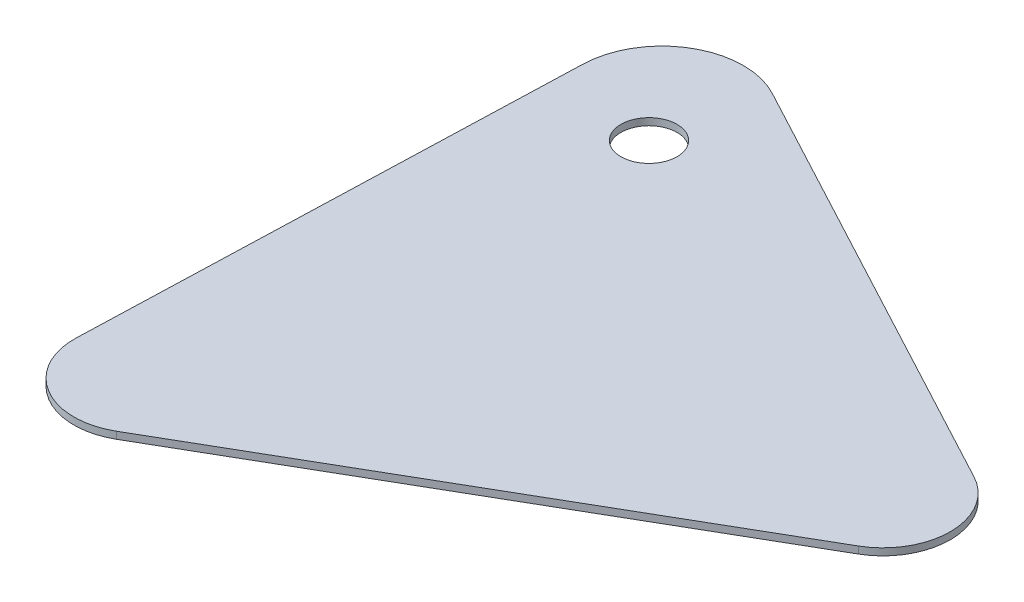
from build123d import *

# Parameters (mm, degrees)
BOSS_EXTRUDE1_DEPTH = 3.175
SKETCH2_R           = 12.7
CUT_EXTRUDE1_DEPTH  = 76.2
FILLET1_R           = 30.48


with BuildPart() as part:
    # Sketch1 → Boss-Extrude1 (new body)
    with BuildSketch(Plane(origin=(0, 0, 0), x_dir=(1, 0, 0), z_dir=(0, 1, 0))):
        with BuildLine():
            Line((211.534409722, 68.311873697), (-33.027609136, 198.909430038))
            ThreePointArc((-33.027609136, 198.909430038), (-68.829570139, 198.316531428), (-87.244015898, 167.607572999))
            Line((-87.244015898, 167.607572999), (-96.424223864, -109.488126303))
            Line((-96.424223864, -109.488126303), (211.534409722, 68.311873697))
        make_face()
    extrude(amount=BOSS_EXTRUDE1_DEPTH)

    # Sketch2 → Cut-Extrude1 (cut)
    with BuildSketch(Plane(origin=(0, 3.175, 0), x_dir=(1, 0, 0), z_dir=(0, 1, 0))):
        with Locations(Location((-42.355812517, 152.46263816, 0), (0, 0, 270))):
            Circle(SKETCH2_R)
    extrude(amount=-CUT_EXTRUDE1_DEPTH, mode=Mode.SUBTRACT)

    # Fillet1
    fillet1_edges = [part.edges().sort_by_distance(p)[0] for p in [
        (211.534409722, 1.5875, -68.311873697),
        (-96.424223864, 1.5875, 109.488126303),
    ]]
    fillet(fillet1_edges, radius=FILLET1_R)


solid = part.part
